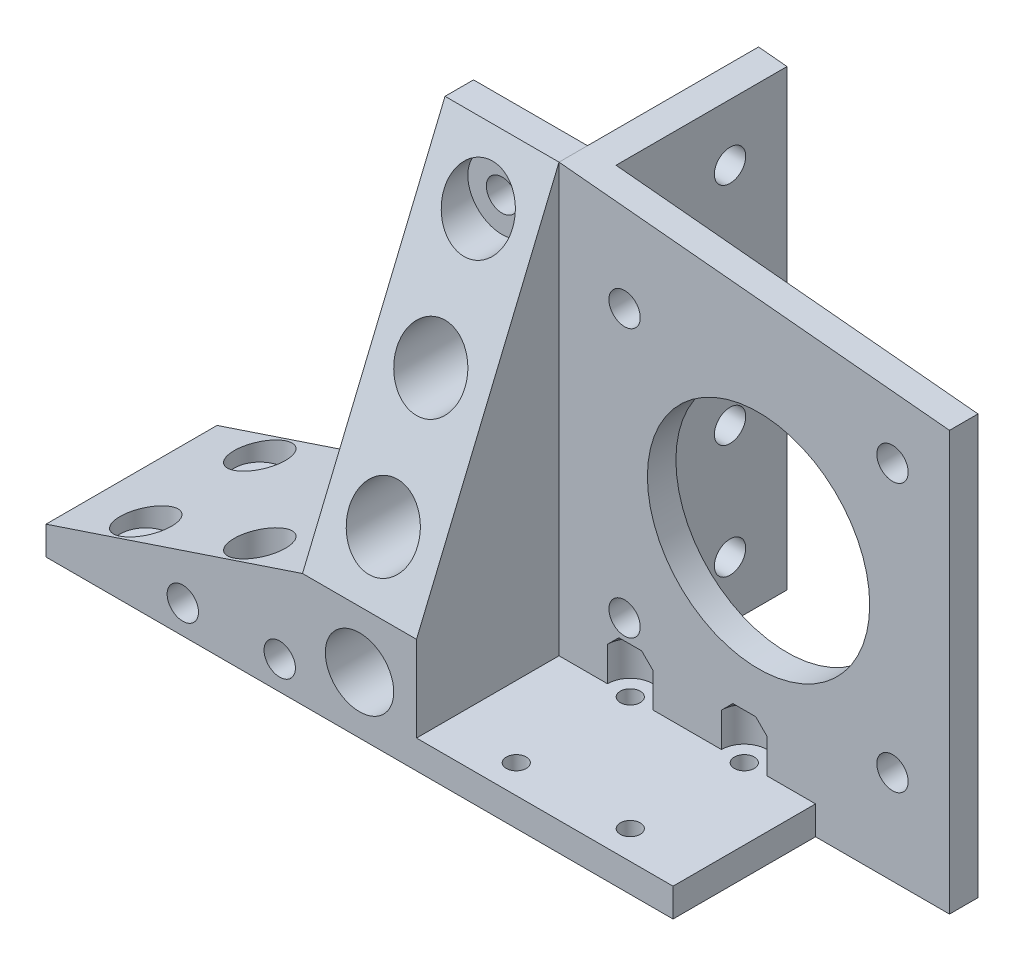
from build123d import *

# Parameters (mm, degrees)
ESQUISSE1_W             = 20
ESQUISSE1_H             = 80
ESQUISSE1_R             = 2.75
BOSS_EXTRU_1_DEPTH      = 5
ESQUISSE3_W             = 45
ESQUISSE3_H             = 5
BOSS_EXTRU_2_DEPTH      = 5
ESQUISSE4_R             = 2.75
BOSS_EXTRU_3_DEPTH      = 25
BOSS_EXTRU_4_DEPTH      = 20
ENL_V_MAT_EXTRU_1_REACH = 78.988
ESQUISSE6_R             = 6
ENL_V_MAT_EXTRU_2_REACH = 103.838
ESQUISSE7_R             = 1.75
ENL_V_MAT_EXTRU_3_REACH = 99.959
ESQUISSE9_R             = 4.5
ESQUISSE11_R            = 19.5
ESQUISSE11_R_2          = 2.75
BOSS_EXTRU_5_DEPTH      = 5
ESQUISSE12_R            = 4
ENL_V_MAT_EXTRU_5_DEPTH = 8
CHANFREIN1_SIZE         = 2
BOSS_EXTRU_6_DEPTH      = 30
ENL_V_MAT_EXTRU_6_REACH = 91.617
ESQUISSE14_R            = 2.75
ENL_V_MAT_EXTRU_7_REACH = 111.813
ESQUISSE15_R            = 2.75


with BuildPart() as part:
    # Esquisse1 → Boss.-Extru.1 (new body)
    with BuildSketch(Plane.XY):
        with Locations((0.415494059, -7.235772358)):
            Rectangle(ESQUISSE1_W, ESQUISSE1_H)
        with Locations((0.415494059, 22.764227642)):
            Circle(ESQUISSE1_R, mode=Mode.SUBTRACT)
        with Locations((0.415494059, -17.235772358)):
            Circle(ESQUISSE1_R, mode=Mode.SUBTRACT)
        with Locations((0.415494059, 2.764227642)):
            Circle(ESQUISSE1_R, mode=Mode.SUBTRACT)
        with Locations((0.415494059, -37.235772358)):
            Circle(ESQUISSE1_R, mode=Mode.SUBTRACT)
    extrude(amount=BOSS_EXTRU_1_DEPTH)

    # Esquisse3 → Boss.-Extru.2 (add)
    with BuildSketch(Plane.XY.offset(5)):
        Polygon((-9.584505941, -47.235772358), (-54.584505941, -47.235772358), (-54.584505941, -42.235772358), (-9.584505941, -27.235772358), align=None)
        with Locations((32.915494059, -44.735772358)):
            Rectangle(ESQUISSE3_W, ESQUISSE3_H)
    extrude(amount=-BOSS_EXTRU_2_DEPTH)

    # Esquisse4 → Boss.-Extru.3 (add)
    with BuildSketch(Plane.XY.offset(5)):
        Polygon((55.415494059, -47.235772358), (55.415494059, -42.235772358), (10.415494059, -42.235772358), (10.415494059, -27.235772358), (-9.584505941, -27.235772358), (-54.584505941, -42.235772358), (-54.584505941, -47.235772358), align=None)
        with Locations((0.415494059, -37.235772358)):
            Circle(ESQUISSE4_R, mode=Mode.SUBTRACT)
    extrude(amount=BOSS_EXTRU_3_DEPTH)

    # Esquisse5 → Boss.-Extru.4 (add)
    with BuildSketch(Plane.ZY.offset(9.584505941)):
        Polygon((5, -27.235772358), (30, -27.235772358), (5, 32.764227642), align=None)
    extrude(amount=-BOSS_EXTRU_4_DEPTH)

    # Esquisse6 → Enlèv. mat.-Extru.1 (cut, up to next)
    with BuildSketch(Plane(origin=(0, 0, 5), x_dir=(-1, 0, 0), z_dir=(0, 0, -1)), mode=Mode.PRIVATE) as enl_v_mat_extru_1_sk1:
        with Locations((-0.415494059, 2.764227642)):
            Circle(ESQUISSE6_R)
    enl_v_mat_extru_1_tool1 = extrude(enl_v_mat_extru_1_sk1.sketch, amount=-ENL_V_MAT_EXTRU_1_REACH, mode=Mode.PRIVATE) & part.part
    # Esquisse6 → Enlèv. mat.-Extru.1 (cut, up to next)
    with BuildSketch(Plane(origin=(0, 0, 5), x_dir=(-1, 0, 0), z_dir=(0, 0, -1)), mode=Mode.PRIVATE) as enl_v_mat_extru_1_sk2:
        with Locations((-0.415494059, -17.235772358)):
            Circle(ESQUISSE6_R)
    enl_v_mat_extru_1_tool2 = extrude(enl_v_mat_extru_1_sk2.sketch, amount=-ENL_V_MAT_EXTRU_1_REACH, mode=Mode.PRIVATE) & part.part
    # Esquisse6 → Enlèv. mat.-Extru.1 (cut, up to next)
    with BuildSketch(Plane(origin=(0, 0, 5), x_dir=(-1, 0, 0), z_dir=(0, 0, -1)), mode=Mode.PRIVATE) as enl_v_mat_extru_1_sk3:
        with Locations((-0.415494059, 22.764227642)):
            Circle(ESQUISSE6_R)
    enl_v_mat_extru_1_tool3 = extrude(enl_v_mat_extru_1_sk3.sketch, amount=-ENL_V_MAT_EXTRU_1_REACH, mode=Mode.PRIVATE) & part.part
    # Esquisse6 → Enlèv. mat.-Extru.1 (cut, up to next)
    with BuildSketch(Plane(origin=(0, 0, 5), x_dir=(-1, 0, 0), z_dir=(0, 0, -1)), mode=Mode.PRIVATE) as enl_v_mat_extru_1_sk4:
        with Locations((-0.415494059, -37.235772358)):
            Circle(ESQUISSE6_R)
    enl_v_mat_extru_1_tool4 = extrude(enl_v_mat_extru_1_sk4.sketch, amount=-ENL_V_MAT_EXTRU_1_REACH, mode=Mode.PRIVATE) & part.part
    add(enl_v_mat_extru_1_tool1.solids().sort_by_distance((0.415494, 2.764228, 5))[0], mode=Mode.SUBTRACT)
    add(enl_v_mat_extru_1_tool2.solids().sort_by_distance((0.415494, -17.235772, 5))[0], mode=Mode.SUBTRACT)
    add(enl_v_mat_extru_1_tool3.solids().sort_by_distance((0.415494, 22.764228, 5))[0], mode=Mode.SUBTRACT)
    add(enl_v_mat_extru_1_tool4.solids().sort_by_distance((0.415494, -37.235772, 5))[0], mode=Mode.SUBTRACT)

    # Esquisse7 → Enlèv. mat.-Extru.2 (cut, up to next)
    with BuildSketch(Plane.XZ.offset(47.235772358), mode=Mode.PRIVATE) as enl_v_mat_extru_2_sk1:
        with Locations(Location((-42.084505941, 25, 0), (0, 0, 270))):
            Circle(ESQUISSE7_R)
    enl_v_mat_extru_2_tool1 = extrude(enl_v_mat_extru_2_sk1.sketch, amount=-ENL_V_MAT_EXTRU_2_REACH, mode=Mode.PRIVATE) & part.part
    # Esquisse7 → Enlèv. mat.-Extru.2 (cut, up to next)
    with BuildSketch(Plane.XZ.offset(47.235772358), mode=Mode.PRIVATE) as enl_v_mat_extru_2_sk2:
        with Locations(Location((-22.084505941, 25, 0), (0, 0, 270))):
            Circle(ESQUISSE7_R)
    enl_v_mat_extru_2_tool2 = extrude(enl_v_mat_extru_2_sk2.sketch, amount=-ENL_V_MAT_EXTRU_2_REACH, mode=Mode.PRIVATE) & part.part
    # Esquisse7 → Enlèv. mat.-Extru.2 (cut, up to next)
    with BuildSketch(Plane.XZ.offset(47.235772358), mode=Mode.PRIVATE) as enl_v_mat_extru_2_sk3:
        with Locations(Location((-22.084505941, 5, 0), (0, 0, 270))):
            Circle(ESQUISSE7_R)
    enl_v_mat_extru_2_tool3 = extrude(enl_v_mat_extru_2_sk3.sketch, amount=-ENL_V_MAT_EXTRU_2_REACH, mode=Mode.PRIVATE) & part.part
    # Esquisse7 → Enlèv. mat.-Extru.2 (cut, up to next)
    with BuildSketch(Plane.XZ.offset(47.235772358), mode=Mode.PRIVATE) as enl_v_mat_extru_2_sk4:
        with Locations(Location((-42.084505941, 5, 0), (0, 0, 270))):
            Circle(ESQUISSE7_R)
    enl_v_mat_extru_2_tool4 = extrude(enl_v_mat_extru_2_sk4.sketch, amount=-ENL_V_MAT_EXTRU_2_REACH, mode=Mode.PRIVATE) & part.part
    # Esquisse7 → Enlèv. mat.-Extru.2 (cut, up to next)
    with BuildSketch(Plane.XZ.offset(47.235772358), mode=Mode.PRIVATE) as enl_v_mat_extru_2_sk5:
        with Locations(Location((42.915494059, 25, 0), (0, 0, 270))):
            Circle(ESQUISSE7_R)
    enl_v_mat_extru_2_tool5 = extrude(enl_v_mat_extru_2_sk5.sketch, amount=-ENL_V_MAT_EXTRU_2_REACH, mode=Mode.PRIVATE) & part.part
    # Esquisse7 → Enlèv. mat.-Extru.2 (cut, up to next)
    with BuildSketch(Plane.XZ.offset(47.235772358), mode=Mode.PRIVATE) as enl_v_mat_extru_2_sk6:
        with Locations(Location((42.915494059, 5, 0), (0, 0, 270))):
            Circle(ESQUISSE7_R)
    enl_v_mat_extru_2_tool6 = extrude(enl_v_mat_extru_2_sk6.sketch, amount=-ENL_V_MAT_EXTRU_2_REACH, mode=Mode.PRIVATE) & part.part
    # Esquisse7 → Enlèv. mat.-Extru.2 (cut, up to next)
    with BuildSketch(Plane.XZ.offset(47.235772358), mode=Mode.PRIVATE) as enl_v_mat_extru_2_sk7:
        with Locations(Location((22.915494059, 5, 0), (0, 0, 270))):
            Circle(ESQUISSE7_R)
    enl_v_mat_extru_2_tool7 = extrude(enl_v_mat_extru_2_sk7.sketch, amount=-ENL_V_MAT_EXTRU_2_REACH, mode=Mode.PRIVATE) & part.part
    # Esquisse7 → Enlèv. mat.-Extru.2 (cut, up to next)
    with BuildSketch(Plane.XZ.offset(47.235772358), mode=Mode.PRIVATE) as enl_v_mat_extru_2_sk8:
        with Locations(Location((22.915494059, 25, 0), (0, 0, 270))):
            Circle(ESQUISSE7_R)
    enl_v_mat_extru_2_tool8 = extrude(enl_v_mat_extru_2_sk8.sketch, amount=-ENL_V_MAT_EXTRU_2_REACH, mode=Mode.PRIVATE) & part.part
    add(enl_v_mat_extru_2_tool1.solids().sort_by_distance((-42.084506, -47.235772, 25))[0], mode=Mode.SUBTRACT)
    add(enl_v_mat_extru_2_tool2.solids().sort_by_distance((-22.084506, -47.235772, 25))[0], mode=Mode.SUBTRACT)
    add(enl_v_mat_extru_2_tool3.solids().sort_by_distance((-22.084506, -47.235772, 5))[0], mode=Mode.SUBTRACT)
    add(enl_v_mat_extru_2_tool4.solids().sort_by_distance((-42.084506, -47.235772, 5))[0], mode=Mode.SUBTRACT)
    add(enl_v_mat_extru_2_tool5.solids().sort_by_distance((42.915494, -47.235772, 25))[0], mode=Mode.SUBTRACT)
    add(enl_v_mat_extru_2_tool6.solids().sort_by_distance((42.915494, -47.235772, 5))[0], mode=Mode.SUBTRACT)
    add(enl_v_mat_extru_2_tool7.solids().sort_by_distance((22.915494, -47.235772, 5))[0], mode=Mode.SUBTRACT)
    add(enl_v_mat_extru_2_tool8.solids().sort_by_distance((22.915494, -47.235772, 25))[0], mode=Mode.SUBTRACT)

    # Enlèv. mat.-Extru.3: up to this plane
    enl_v_mat_extru_3_end = Plane(origin=(-54.584505941, -42.235772358, 0), z_dir=(-0.31622776601683844, 0.9486832980505137, 0))
    # Esquisse9 → Enlèv. mat.-Extru.3 (cut, up to the surface)
    with BuildSketch(Plane(origin=(0, -42.235772358, 0), x_dir=(-1, 0, 0), z_dir=(0, -1, 0)), mode=Mode.PRIVATE) as enl_v_mat_extru_3_sk1:
        with Locations(Location((42.084505941, -25, 0), (0, 0, 90))):
            Circle(ESQUISSE9_R)
    enl_v_mat_extru_3_tool1 = split(extrude(enl_v_mat_extru_3_sk1.sketch, amount=-ENL_V_MAT_EXTRU_3_REACH, mode=Mode.PRIVATE), bisect_by=enl_v_mat_extru_3_end, keep=Keep.BOTH, mode=Mode.PRIVATE)
    add(enl_v_mat_extru_3_tool1.solids().sort_by_distance((-42.084506, -42.235772, 25))[0], mode=Mode.SUBTRACT)
    # Esquisse9 → Enlèv. mat.-Extru.3 (cut, up to the surface)
    with BuildSketch(Plane(origin=(0, -42.235772358, 0), x_dir=(-1, 0, 0), z_dir=(0, -1, 0)), mode=Mode.PRIVATE) as enl_v_mat_extru_3_sk2:
        with Locations(Location((22.084505941, -25, 0), (0, 0, 90))):
            Circle(ESQUISSE9_R)
    enl_v_mat_extru_3_tool2 = split(extrude(enl_v_mat_extru_3_sk2.sketch, amount=-ENL_V_MAT_EXTRU_3_REACH, mode=Mode.PRIVATE), bisect_by=enl_v_mat_extru_3_end, keep=Keep.BOTH, mode=Mode.PRIVATE)
    add(enl_v_mat_extru_3_tool2.solids().sort_by_distance((-22.084506, -42.235772, 25))[0], mode=Mode.SUBTRACT)
    # Esquisse9 → Enlèv. mat.-Extru.3 (cut, up to the surface)
    with BuildSketch(Plane(origin=(0, -42.235772358, 0), x_dir=(-1, 0, 0), z_dir=(0, -1, 0)), mode=Mode.PRIVATE) as enl_v_mat_extru_3_sk3:
        with Locations(Location((22.084505941, -5, 0), (0, 0, 90))):
            Circle(ESQUISSE9_R)
    enl_v_mat_extru_3_tool3 = split(extrude(enl_v_mat_extru_3_sk3.sketch, amount=-ENL_V_MAT_EXTRU_3_REACH, mode=Mode.PRIVATE), bisect_by=enl_v_mat_extru_3_end, keep=Keep.BOTH, mode=Mode.PRIVATE)
    add(enl_v_mat_extru_3_tool3.solids().sort_by_distance((-22.084506, -42.235772, 5))[0], mode=Mode.SUBTRACT)
    # Esquisse9 → Enlèv. mat.-Extru.3 (cut, up to the surface)
    with BuildSketch(Plane(origin=(0, -42.235772358, 0), x_dir=(-1, 0, 0), z_dir=(0, -1, 0)), mode=Mode.PRIVATE) as enl_v_mat_extru_3_sk4:
        with Locations(Location((42.084505941, -5, 0), (0, 0, 90))):
            Circle(ESQUISSE9_R)
    enl_v_mat_extru_3_tool4 = split(extrude(enl_v_mat_extru_3_sk4.sketch, amount=-ENL_V_MAT_EXTRU_3_REACH, mode=Mode.PRIVATE), bisect_by=enl_v_mat_extru_3_end, keep=Keep.BOTH, mode=Mode.PRIVATE)
    add(enl_v_mat_extru_3_tool4.solids().sort_by_distance((-42.084506, -42.235772, 5))[0], mode=Mode.SUBTRACT)

    # Esquisse11 → Boss.-Extru.5 (add)
    with BuildSketch(Plane(origin=(0, 0, 0), x_dir=(-1, 0, 0), z_dir=(0, 0, -1))):
        Polygon((-10.415494059, -42.235772358), (-55.415494059, -42.235772358), (-55.415494059, -47.235772358), (-78.915494059, -47.235772358), (-78.915494059, 26.264227642), (-10.415494059, 32.764227642), align=None)
        with Locations((-45.415494059, -7.235772358)):
            Circle(ESQUISSE11_R, mode=Mode.SUBTRACT)
        with Locations((-21.915494059, 16.264227642)):
            Circle(ESQUISSE11_R_2, mode=Mode.SUBTRACT)
        with Locations((-21.915494059, -30.735772358)):
            Circle(ESQUISSE11_R_2, mode=Mode.SUBTRACT)
        with Locations((-68.915494059, -30.735772358)):
            Circle(ESQUISSE11_R_2, mode=Mode.SUBTRACT)
        with Locations((-68.915494059, 16.264227642)):
            Circle(ESQUISSE11_R_2, mode=Mode.SUBTRACT)
    extrude(amount=-BOSS_EXTRU_5_DEPTH)

    # Esquisse12 → Enlèv. mat.-Extru.5 (cut)
    with BuildSketch(Plane(origin=(0, -42.235772358, 0), x_dir=(1, 0, 0), z_dir=(0, 1, 0))):
        with Locations((22.915494059, -5)):
            Circle(ESQUISSE12_R)
        with Locations((42.915494059, -5)):
            Circle(ESQUISSE12_R)
    extrude(amount=ENL_V_MAT_EXTRU_5_DEPTH, mode=Mode.SUBTRACT)

    # Chanfrein1
    chanfrein1_edges = [part.edges().sort_by_distance(p)[0] for p in [
        (22.915494059, -34.235772358, 1),
        (42.915494059, -34.235772358, 1),
    ]]
    chamfer(chanfrein1_edges, length=CHANFREIN1_SIZE)

    # Esquisse13 → Boss.-Extru.6 (add)
    with BuildSketch(Plane(origin=(0, 0, 0), x_dir=(-1, 0, 0), z_dir=(0, 0, -1))):
        Polygon((-10.415494059, 32.764227642), (-15.415494059, 32.289775088), (-15.415494059, -47.235772358), (-10.415494059, -47.235772358), align=None)
    extrude(amount=BOSS_EXTRU_6_DEPTH)

    # Esquisse14 → Enlèv. mat.-Extru.6 (cut, up to next)
    with BuildSketch(Plane(origin=(15.415494059, 0, 0), x_dir=(0, 0, -1), z_dir=(1, 0, 0)), mode=Mode.PRIVATE) as enl_v_mat_extru_6_sk1:
        with Locations(Location((20, 22.289775088, 0), (0, 0, 90))):
            Circle(ESQUISSE14_R)
    enl_v_mat_extru_6_tool1 = extrude(enl_v_mat_extru_6_sk1.sketch, amount=-ENL_V_MAT_EXTRU_6_REACH, mode=Mode.PRIVATE) & part.part
    # Esquisse14 → Enlèv. mat.-Extru.6 (cut, up to next)
    with BuildSketch(Plane(origin=(15.415494059, 0, 0), x_dir=(0, 0, -1), z_dir=(1, 0, 0)), mode=Mode.PRIVATE) as enl_v_mat_extru_6_sk2:
        with Locations(Location((20, 2.289775088, 0), (0, 0, 90))):
            Circle(ESQUISSE14_R)
    enl_v_mat_extru_6_tool2 = extrude(enl_v_mat_extru_6_sk2.sketch, amount=-ENL_V_MAT_EXTRU_6_REACH, mode=Mode.PRIVATE) & part.part
    # Esquisse14 → Enlèv. mat.-Extru.6 (cut, up to next)
    with BuildSketch(Plane(origin=(15.415494059, 0, 0), x_dir=(0, 0, -1), z_dir=(1, 0, 0)), mode=Mode.PRIVATE) as enl_v_mat_extru_6_sk3:
        with Locations(Location((20, -17.235772358, 0), (0, 0, 90))):
            Circle(ESQUISSE14_R)
    enl_v_mat_extru_6_tool3 = extrude(enl_v_mat_extru_6_sk3.sketch, amount=-ENL_V_MAT_EXTRU_6_REACH, mode=Mode.PRIVATE) & part.part
    # Esquisse14 → Enlèv. mat.-Extru.6 (cut, up to next)
    with BuildSketch(Plane(origin=(15.415494059, 0, 0), x_dir=(0, 0, -1), z_dir=(1, 0, 0)), mode=Mode.PRIVATE) as enl_v_mat_extru_6_sk4:
        with Locations(Location((20, -37.235772358, 0), (0, 0, 90))):
            Circle(ESQUISSE14_R)
    enl_v_mat_extru_6_tool4 = extrude(enl_v_mat_extru_6_sk4.sketch, amount=-ENL_V_MAT_EXTRU_6_REACH, mode=Mode.PRIVATE) & part.part
    add(enl_v_mat_extru_6_tool1.solids().sort_by_distance((15.415494, 22.289775, -20))[0], mode=Mode.SUBTRACT)
    add(enl_v_mat_extru_6_tool2.solids().sort_by_distance((15.415494, 2.289775, -20))[0], mode=Mode.SUBTRACT)
    add(enl_v_mat_extru_6_tool3.solids().sort_by_distance((15.415494, -17.235772, -20))[0], mode=Mode.SUBTRACT)
    add(enl_v_mat_extru_6_tool4.solids().sort_by_distance((15.415494, -37.235772, -20))[0], mode=Mode.SUBTRACT)

    # Esquisse15 → Enlèv. mat.-Extru.7 (cut, up to next)
    with BuildSketch(Plane.XY.offset(30), mode=Mode.PRIVATE) as enl_v_mat_extru_7_sk1:
        with Locations((-13.584505941, -42.235772358)):
            Circle(ESQUISSE15_R)
    enl_v_mat_extru_7_tool1 = extrude(enl_v_mat_extru_7_sk1.sketch, amount=-ENL_V_MAT_EXTRU_7_REACH, mode=Mode.PRIVATE) & part.part
    # Esquisse15 → Enlèv. mat.-Extru.7 (cut, up to next)
    with BuildSketch(Plane.XY.offset(30), mode=Mode.PRIVATE) as enl_v_mat_extru_7_sk2:
        with Locations((-30.584505941, -42.235772358)):
            Circle(ESQUISSE15_R)
    enl_v_mat_extru_7_tool2 = extrude(enl_v_mat_extru_7_sk2.sketch, amount=-ENL_V_MAT_EXTRU_7_REACH, mode=Mode.PRIVATE) & part.part
    add(enl_v_mat_extru_7_tool1.solids().sort_by_distance((-13.584506, -42.235772, 30))[0], mode=Mode.SUBTRACT)
    add(enl_v_mat_extru_7_tool2.solids().sort_by_distance((-30.584506, -42.235772, 30))[0], mode=Mode.SUBTRACT)


solid = part.part
